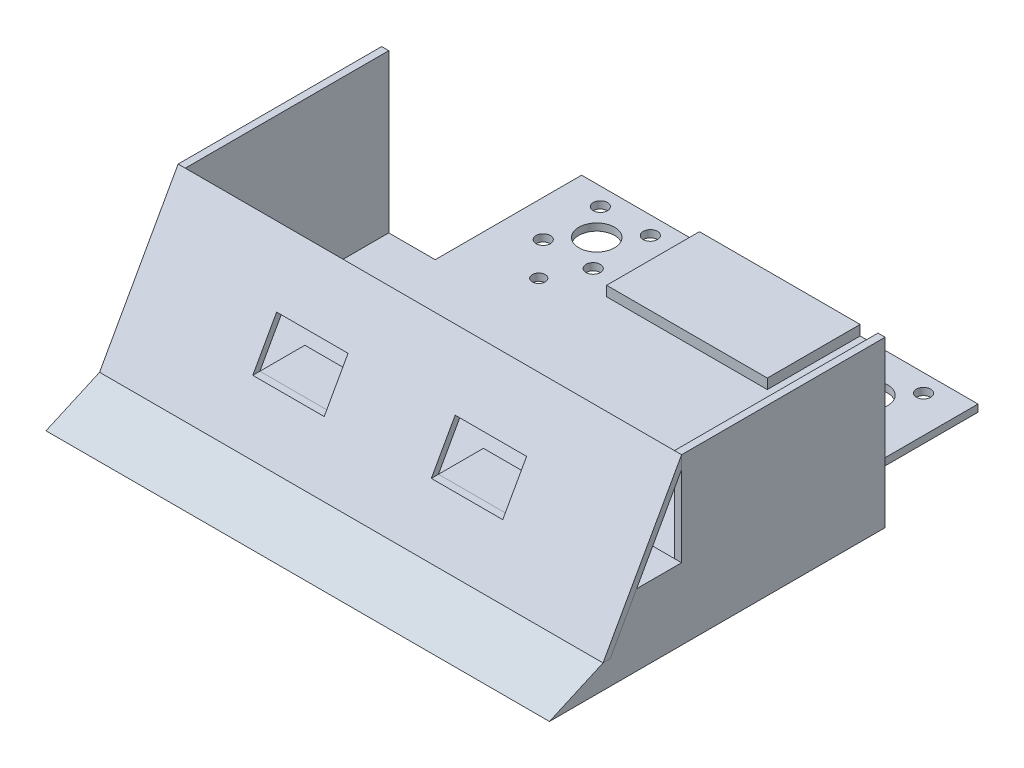
from build123d import *

# Parameters (mm, degrees)
SKETCH1_R                 = 1.8
SKETCH1_R_2               = 2
SKETCH1_R_3               = 5
BOSS_EXTRUDE1_DEPTH       = 2
BOSS_EXTRUDE6_DEPTH       = 70.5
BOSS_EXTRUDE6_DEPTH_BACK  = 70.5
CUT_EXTRUDE8_DEPTH        = 15
CUT_EXTRUDE8_DEPTH_BACK   = 15
CUT_EXTRUDE9_START        = -35
CUT_EXTRUDE9_DEPTH        = 25
CUT_EXTRUDE10_START       = 35
CUT_EXTRUDE10_DEPTH       = 25
CUT_EXTRUDE11_DEPTH       = 70.5
CUT_EXTRUDE11_DEPTH_BACK  = 70.5
CUT_EXTRUDE12_START       = 115
SKETCH11_W                = 25
SKETCH11_H                = 4.698729811
CUT_EXTRUDE12_DEPTH       = 20
CUT_EXTRUDE13_START       = 4
SKETCH7_R                 = 5
CUT_EXTRUDE13_DEPTH       = 10
BOSS_EXTRUDE7_DEPTH       = 70.5
BOSS_EXTRUDE7_DEPTH_BACK  = 70.5
SKETCH15_W                = 2
SKETCH15_H                = 57.000000003
BOSS_EXTRUDE8_DEPTH       = 46.2
CUT_EXTRUDE16_START       = -15
SKETCH13_W                = 14.59259259
SKETCH13_H                = 12
CUT_EXTRUDE16_DEPTH       = 20
CUT_EXTRUDE17_START       = 15
SKETCH13_3_W              = 14.59259259
SKETCH13_3_H              = 12
CUT_EXTRUDE17_DEPTH       = 20
BOSS_EXTRUDE9_DEPTH       = 4.8
BOSS_EXTRUDE10_DEPTH      = 70.5
BOSS_EXTRUDE10_DEPTH_BACK = 70.5


with BuildPart() as part:
    # Sketch1 → Boss-Extrude1 (new body)
    with BuildSketch(Plane(origin=(0, 0, 0), x_dir=(1, 0, 0), z_dir=(0, 1, 0))):
        Polygon((-55.5, 0), (55.509756816, 0), (55.509756816, -41), (70.5, -41), (70.5, -120), (-70.5, -120), (-70.5, -41), (-55.5, -41), align=None)
        with Locations(Location((-36.5, -90.02394851, 0), (0, 0, 270))):
            Circle(SKETCH1_R, mode=Mode.SUBTRACT)
        with Locations(Location((36.5, -31, 0), (0, 0, 270))):
            Circle(SKETCH1_R, mode=Mode.SUBTRACT)
        with Locations(Location((36.5, -90.02394851, 0), (0, 0, 270))):
            Circle(SKETCH1_R, mode=Mode.SUBTRACT)
        with Locations(Location((-36.5, -31, 0), (0, 0, 270))):
            Circle(SKETCH1_R, mode=Mode.SUBTRACT)
        with Locations(Location((-45.25, -21, 0), (0, 0, 270))):
            Circle(SKETCH1_R_2, mode=Mode.SUBTRACT)
        with Locations(Location((-31.25, -21, 0), (0, 0, 270))):
            Circle(SKETCH1_R_2, mode=Mode.SUBTRACT)
        with Locations(Location((-31.25, -5, 0), (0, 0, 270))):
            Circle(SKETCH1_R_2, mode=Mode.SUBTRACT)
        with Locations(Location((-45.25, -5, 0), (0, 0, 270))):
            Circle(SKETCH1_R_2, mode=Mode.SUBTRACT)
        with Locations(Location((-38.268185647, -13, 0), (0, 0, 270))):
            Circle(SKETCH1_R_3, mode=Mode.SUBTRACT)
        with Locations(Location((31.259756816, -21, 0), (0, 0, 270))):
            Circle(SKETCH1_R_2, mode=Mode.SUBTRACT)
        with Locations(Location((45.259756816, -21, 0), (0, 0, 270))):
            Circle(SKETCH1_R_2, mode=Mode.SUBTRACT)
        with Locations(Location((45.259756816, -5, 0), (0, 0, 270))):
            Circle(SKETCH1_R_2, mode=Mode.SUBTRACT)
        with Locations(Location((31.259756816, -5, 0), (0, 0, 270))):
            Circle(SKETCH1_R_2, mode=Mode.SUBTRACT)
        with Locations(Location((38.25, -13, 0), (0, 0, 270))):
            Circle(SKETCH1_R_3, mode=Mode.SUBTRACT)
    extrude(amount=BOSS_EXTRUDE1_DEPTH)

    # Sketch2<9> → Boss-Extrude6 (add, two sides: drawn at the far end of the back side and taken through both)
    with BuildSketch(Plane(origin=(0, 0, 0), x_dir=(0, 0, -1), z_dir=(1, 0, 0)).offset(-BOSS_EXTRUDE6_DEPTH_BACK)):
        Polygon((-98.000000003, 20), (-110.592592593, 20), (-112.592592593, 20), (-120, 6.698729811), (-120, 2), (-98.000000003, 2), (-98.000000003, 6.698729811), align=None)
    extrude(amount=BOSS_EXTRUDE6_DEPTH + BOSS_EXTRUDE6_DEPTH_BACK)

    # Sketch2<15> → Cut-Extrude8 (cut, two sides: drawn at the far end of the back side and taken through both)
    with BuildSketch(Plane(origin=(0, 0, 0), x_dir=(0, 0, -1), z_dir=(1, 0, 0)).offset(-CUT_EXTRUDE8_DEPTH_BACK)):
        Polygon((-98.000000003, 20), (-110.592592593, 20), (-112.592592593, 20), (-120, 6.698729811), (-118, 6.698729811), (-98.000000003, 6.698729811), align=None)
    extrude(amount=CUT_EXTRUDE8_DEPTH + CUT_EXTRUDE8_DEPTH_BACK, mode=Mode.SUBTRACT)

    # Sketch2<17> → Cut-Extrude9 (cut)
    with BuildSketch(Plane(origin=(0, 0, 0), x_dir=(0, 0, -1), z_dir=(1, 0, 0)).offset(CUT_EXTRUDE9_START)):
        Polygon((-98.000000003, 20), (-110.592592593, 20), (-112.592592593, 20), (-120, 6.698729811), (-118, 6.698729811), (-98.000000003, 6.698729811), align=None)
    extrude(amount=-CUT_EXTRUDE9_DEPTH, mode=Mode.SUBTRACT)

    # Sketch2<18> → Cut-Extrude10 (cut)
    with BuildSketch(Plane(origin=(0, 0, 0), x_dir=(0, 0, -1), z_dir=(1, 0, 0)).offset(CUT_EXTRUDE10_START)):
        Polygon((-98.000000003, 20), (-110.592592593, 20), (-112.592592593, 20), (-120, 6.698729811), (-118, 6.698729811), (-98.000000003, 6.698729811), align=None)
    extrude(amount=CUT_EXTRUDE10_DEPTH, mode=Mode.SUBTRACT)

    # Sketch2 → Cut-Extrude11 (cut, two sides: drawn at the far end of the back side and taken through both)
    with BuildSketch(Plane(origin=(0, 0, 0), x_dir=(0, 0, -1), z_dir=(1, 0, 0)).offset(-CUT_EXTRUDE11_DEPTH_BACK)):
        Polygon((-120, 6.698729811), (-112.592592593, 20), (-110.592592593, 20), (-118, 6.698729811), align=None)
    extrude(amount=CUT_EXTRUDE11_DEPTH + CUT_EXTRUDE11_DEPTH_BACK, mode=Mode.SUBTRACT)

    # Sketch11 → Cut-Extrude12 (cut)
    with BuildSketch(Plane.XY.offset(CUT_EXTRUDE12_START)):
        with Locations((-47.5, 4.349364905)):
            Rectangle(SKETCH11_W, SKETCH11_H)
        with Locations((47.5, 4.349364905)):
            Rectangle(SKETCH11_W, SKETCH11_H)
    extrude(amount=-CUT_EXTRUDE12_DEPTH, mode=Mode.SUBTRACT)

    # Sketch7 → Cut-Extrude13 (cut)
    with BuildSketch(Plane(origin=(0, 0, 0), x_dir=(1, 0, 0), z_dir=(0, 1, 0)).offset(CUT_EXTRUDE13_START)):
        with Locations(Location((-47.998437473, -104.630567113, 0), (0, 0, 270))):
            Circle(SKETCH7_R)
        with Locations(Location((48, -105.005567113, 0), (0, 0, 270))):
            Circle(SKETCH7_R)
    extrude(amount=-CUT_EXTRUDE13_DEPTH, mode=Mode.SUBTRACT)

    # Sketch15 → Boss-Extrude8 (add)
    with BuildSketch(Plane(origin=(0, 0, 0), x_dir=(1, 0, 0), z_dir=(0, 1, 0))):
        with Locations((-69.5, -69.500000002)):
            Rectangle(SKETCH15_W, SKETCH15_H)
        with Locations((69.5, -69.500000002)):
            Rectangle(SKETCH15_W, SKETCH15_H)
    extrude(amount=BOSS_EXTRUDE8_DEPTH)

    # Sketch17 → Boss-Extrude9 (add)
    with BuildSketch(Plane(origin=(0, 0, 0), x_dir=(1, 0, 0), z_dir=(0, 1, 0))):
        Polygon((0.004878408, 0), (22.504878408, 0), (22.504878408, -26), (-22.495121592, -26), (-22.495121592, 0), align=None)
    extrude(amount=BOSS_EXTRUDE9_DEPTH)

    # Sketch2<22> → Boss-Extrude10 (add, two sides: drawn at the far end of the back side and taken through both)
    with BuildSketch(Plane(origin=(0, 0, 0), x_dir=(0, 0, -1), z_dir=(1, 0, 0)).offset(-BOSS_EXTRUDE10_DEPTH_BACK)):
        Polygon((-120, 6.698729811), (-120, 2), (-120, 0), (-135, 0), align=None)
    extrude(amount=BOSS_EXTRUDE10_DEPTH + BOSS_EXTRUDE10_DEPTH_BACK)


with BuildPart() as body_2:
    # Sketch12 → Boss-Extrude7 (new, two sides: drawn at the far end of the back side and taken through both)
    with BuildSketch(Plane(origin=(0, 0, 0), x_dir=(0, 0, -1), z_dir=(1, 0, 0)).offset(-BOSS_EXTRUDE7_DEPTH_BACK)):
        Polygon((-98.000000003, 42.607820719), (-98.000000003, 46.198729811), (-120, 6.698729811), (-118, 6.698729811), align=None)
    extrude(amount=BOSS_EXTRUDE7_DEPTH + BOSS_EXTRUDE7_DEPTH_BACK)

    # Sketch13 → Cut-Extrude16 (cut)
    with BuildSketch(Plane(origin=(0, 0, 0), x_dir=(0, 0, -1), z_dir=(1, 0, 0)).offset(CUT_EXTRUDE16_START)):
        with Locations((-105.296296298, 26)):
            Rectangle(SKETCH13_W, SKETCH13_H)
    extrude(amount=-CUT_EXTRUDE16_DEPTH, mode=Mode.SUBTRACT)

    # Sketch13<3> → Cut-Extrude17 (cut)
    with BuildSketch(Plane(origin=(0, 0, 0), x_dir=(0, 0, -1), z_dir=(1, 0, 0)).offset(CUT_EXTRUDE17_START)):
        with Locations((-105.296296298, 26)):
            Rectangle(SKETCH13_3_W, SKETCH13_3_H)
    extrude(amount=CUT_EXTRUDE17_DEPTH, mode=Mode.SUBTRACT)


solid = Compound([part.part, body_2.part])
